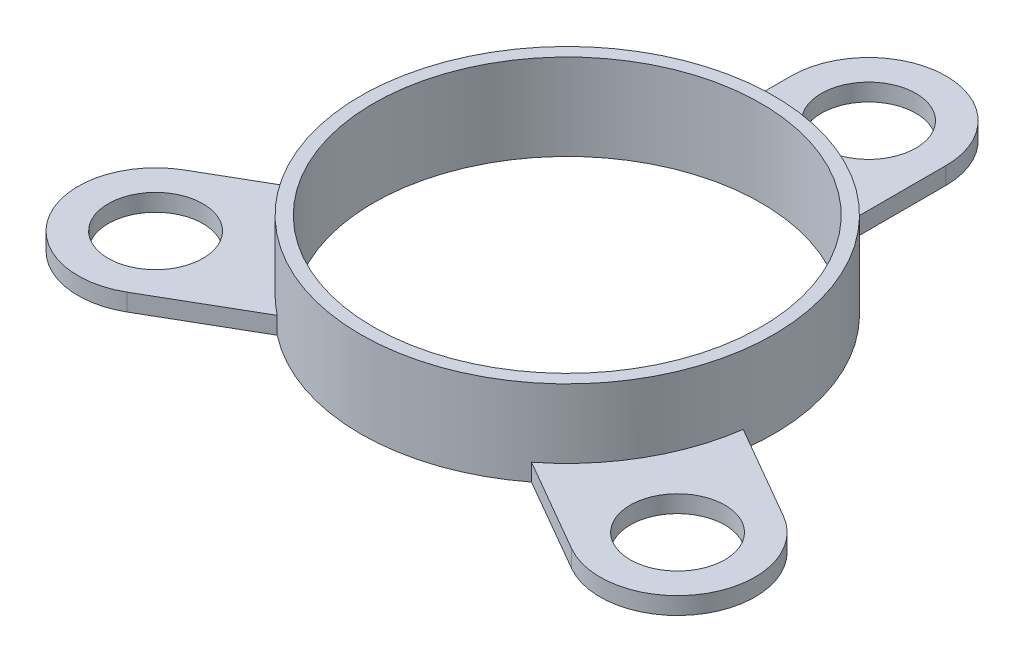
from build123d import *

# Parameters (mm, degrees)
SKETCH1_R             = 2.75
BOSS_EXTRUDE1_DEPTH   = 1
BOSS_EXTRUDE1_2_DEPTH = 1
BOSS_EXTRUDE1_3_DEPTH = 1
SKETCH1_4_R           = 11.25
BOSS_EXTRUDE2_DEPTH   = 5


with BuildPart() as part:
    # Sketch1 → Boss-Extrude1 (new body)
    with BuildSketch(Plane(origin=(0, 0, 0), x_dir=(1, 0, 0), z_dir=(0, 1, 0))):
        with BuildLine():
            ThreePointArc((12.905444566, -12.647114317), (19.052558883, -11), (17.405444566, -4.852885683))
            Line((17.405444566, -4.852885683), (11.883924434, -1.665034548))
            ThreePointArc((11.883924434, -1.665034548), (10.392304845, -6), (7.383924434, -9.459263182))
            Line((7.383924434, -9.459263182), (12.905444566, -12.647114317))
        make_face()
        with Locations((15.155444566, -8.75)):
            Circle(SKETCH1_R, mode=Mode.SUBTRACT)
    extrude(amount=BOSS_EXTRUDE1_DEPTH)



with BuildPart() as body_2:
    # Sketch1 → Boss-Extrude1 2 (new body)
    with BuildSketch(Plane(origin=(0, 0, 0), x_dir=(1, 0, 0), z_dir=(0, 1, 0))):
        with BuildLine():
            ThreePointArc((-17.405444566, -4.852885683), (-19.052558883, -11), (-12.905444566, -12.647114317))
            Line((-12.905444566, -12.647114317), (-7.383924434, -9.459263182))
            ThreePointArc((-7.383924434, -9.459263182), (-10.392304845, -6), (-11.883924434, -1.665034548))
            Line((-11.883924434, -1.665034548), (-17.405444566, -4.852885683))
        make_face()
        with Locations((-15.155444566, -8.75)):
            Circle(SKETCH1_R, mode=Mode.SUBTRACT)
    extrude(amount=BOSS_EXTRUDE1_2_DEPTH)


with BuildPart() as body_3:
    # Sketch1 → Boss-Extrude1 3 (new body)
    with BuildSketch(Plane(origin=(0, 0, 0), x_dir=(1, 0, 0), z_dir=(0, 1, 0))):
        with BuildLine():
            ThreePointArc((-4.5, 11.124297731), (0, 12), (4.5, 11.124297731))
            Line((4.5, 11.124297731), (4.5, 17.5))
            ThreePointArc((4.5, 17.5), (0, 22), (-4.5, 17.5))
            Line((-4.5, 17.5), (-4.5, 11.124297731))
        make_face()
        with Locations((0, 17.5)):
            Circle(SKETCH1_R, mode=Mode.SUBTRACT)
    extrude(amount=BOSS_EXTRUDE1_3_DEPTH)


with BuildPart() as part_1:
    add(part.part)

    add(body_2.part)  # Boss-Extrude2 merges body 2

    add(body_3.part)  # Boss-Extrude2 merges body 3
    # Sketch1<4> → Boss-Extrude2 (add)
    with BuildSketch(Plane(origin=(0, 0, 0), x_dir=(1, 0, 0), z_dir=(0, 1, 0))):
        with BuildLine():
            ThreePointArc((7.383924434, -9.459263182), (10.392304845, -6), (11.883924434, -1.665034548))
            ThreePointArc((11.883924434, -1.665034548), (11.970945936, -0.834537834), (12, 0))
            ThreePointArc((12, 0), (9.949874371, 6.708203932), (4.5, 11.124297731))
            ThreePointArc((4.5, 11.124297731), (0, 12), (-4.5, 11.124297731))
            ThreePointArc((-4.5, 11.124297731), (-10.392304845, 6), (-11.883924434, -1.665034548))
            ThreePointArc((-11.883924434, -1.665034548), (-10.392304845, -6), (-7.383924434, -9.459263182))
            ThreePointArc((-7.383924434, -9.459263182), (0, -12), (7.383924434, -9.459263182))
        make_face()
        Circle(SKETCH1_4_R, mode=Mode.SUBTRACT)
    extrude(amount=BOSS_EXTRUDE2_DEPTH)


solid = part_1.part
